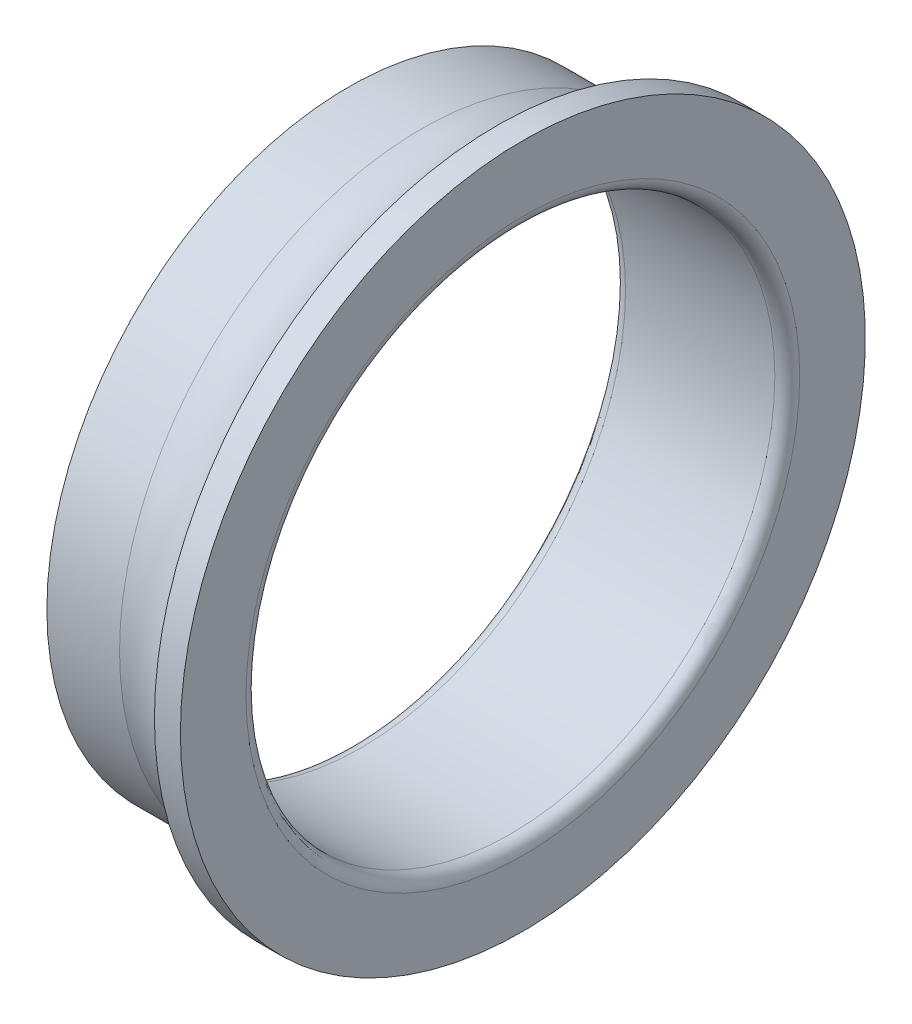
from build123d import *


with BuildPart() as part:
    # Schizzo1 → Rivoluzione1 (revolve)
    with BuildSketch(Plane.XY, mode=Mode.PRIVATE) as rivoluzione1_sk:
        with BuildLine():
            Line((0, 48.51), (0, 44.5))
            ThreePointArc((0, 44.5), (0.585786438, 43.085786438), (2, 42.5))
            Line((2, 42.5), (26, 42.5))
            ThreePointArc((26, 42.5), (27.414213562, 43.085786438), (28, 44.5))
            Line((28, 44.5), (28, 55.05))
            Line((28, 55.05), (23.826494797, 55.05))
            ThreePointArc((23.826494797, 55.05), (18.977115837, 49.504551501), (11.677845828, 48.51))
            Line((11.677845828, 48.51), (0, 48.51))
        make_face()
    revolve(rivoluzione1_sk.sketch.rotate(Axis((28, 0, 0), (-1, 0, 0)), 270), axis=Axis((28, 0, 0), (-1, 0, 0)))


solid = part.part
